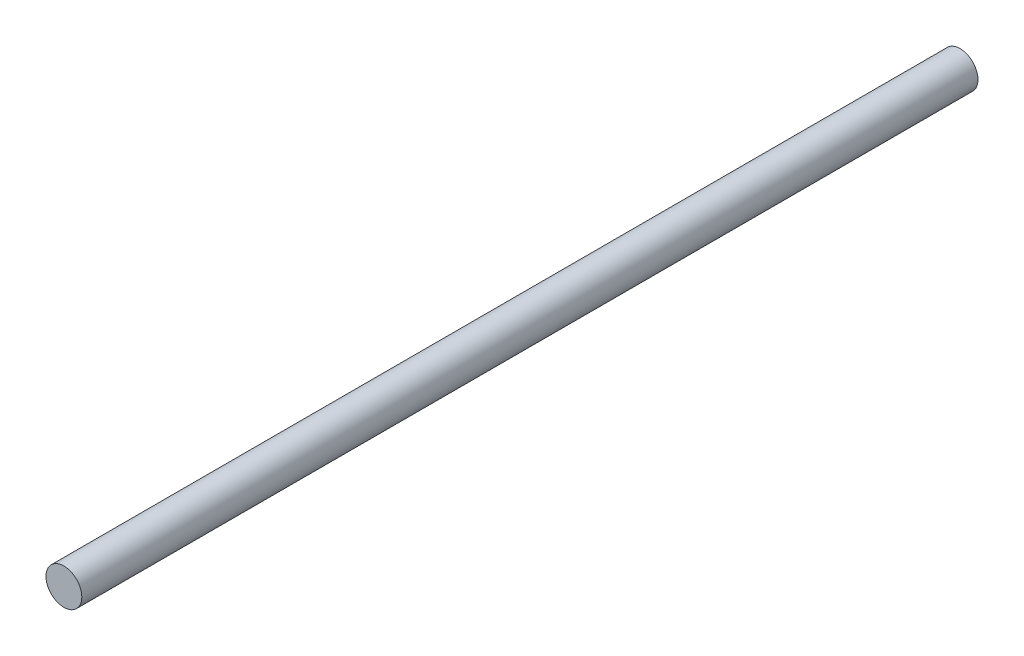
from build123d import *

# Parameters (mm, degrees)
SZKIC1_R                    = 5
DODANIE_WYCI_GNI_CIE1_DEPTH = 250


with BuildPart() as part:
    # Szkic1 → Dodanie-wyciągnięcie1 (new body)
    with BuildSketch(Plane.XY):
        Circle(SZKIC1_R)
    extrude(amount=DODANIE_WYCI_GNI_CIE1_DEPTH)


solid = part.part
